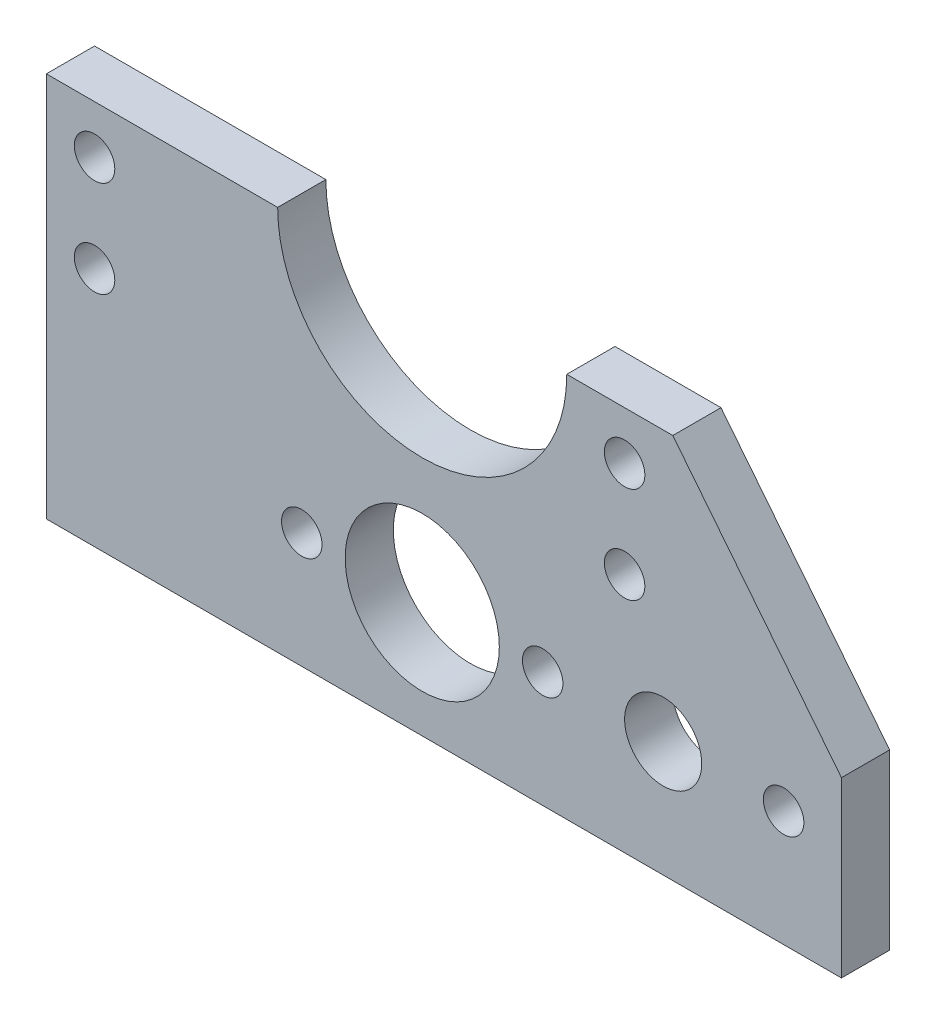
from build123d import *

# Parameters (mm, degrees)
SKETCH1_R           = 2.1
SKETCH1_R_2         = 4
SKETCH1_R_3         = 8
BOSS_EXTRUDE1_DEPTH = 5
SKETCH2_R           = 15
CUT_EXTRUDE1_DEPTH  = 10


with BuildPart() as part:
    # Sketch1 → Boss-Extrude1 (new body)
    with BuildSketch(Plane.XY):
        Polygon((116.611470678, 15.338509317), (51.611470678, 15.338509317), (51.611470678, -6.661490683), (51.611470678, -24.661490683), (116.611470678, -24.661490683), (134.111470678, -24.661490683), (134.111470678, -6.661490683), align=None)
        with Locations((56.611470678, 10.338509317)):
            Circle(SKETCH1_R, mode=Mode.SUBTRACT)
        with Locations((111.611470678, 10.338509317)):
            Circle(SKETCH1_R, mode=Mode.SUBTRACT)
        with Locations((56.611470678, 0.338509317)):
            Circle(SKETCH1_R, mode=Mode.SUBTRACT)
        with Locations((111.611470678, 0.338509317)):
            Circle(SKETCH1_R, mode=Mode.SUBTRACT)
        with Locations((115.611470678, -12.661490683)):
            Circle(SKETCH1_R_2, mode=Mode.SUBTRACT)
        with Locations((90.611470678, -12.661490683)):
            Circle(SKETCH1_R_3, mode=Mode.SUBTRACT)
        with Locations((78.111470678, -12.661490683)):
            Circle(SKETCH1_R, mode=Mode.SUBTRACT)
        with Locations((103.111470678, -12.661490683)):
            Circle(SKETCH1_R, mode=Mode.SUBTRACT)
        with Locations((128.111470678, -12.661490683)):
            Circle(SKETCH1_R, mode=Mode.SUBTRACT)
    extrude(amount=BOSS_EXTRUDE1_DEPTH)

    # Sketch2 → Cut-Extrude1 (cut)
    with BuildSketch(Plane.XY.offset(5)):
        with Locations((90.611470678, 15.338509317)):
            Circle(SKETCH2_R)
    extrude(amount=-CUT_EXTRUDE1_DEPTH, mode=Mode.SUBTRACT)


solid = part.part
